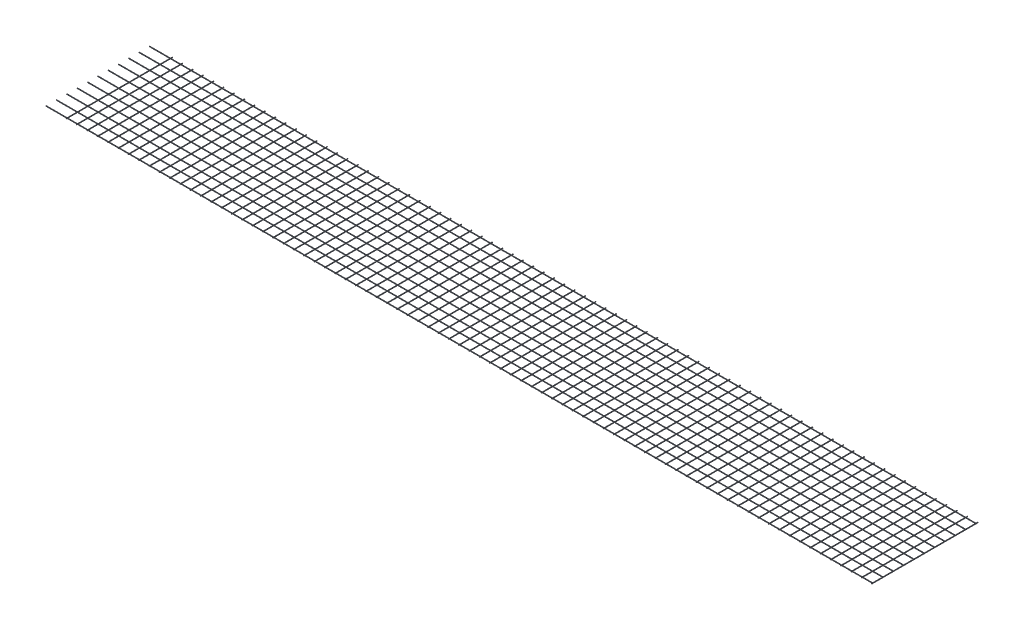
from build123d import *

# Parameters (mm, degrees)
SKETCH1_R              = 2.5
BOSS_EXTRUDE1_DEPTH    = 1025
SKETCH2_R              = 2.5
BOSS_EXTRUDE2_DEPTH    = 8000
BOSS_EXTRUDE2_2_DEPTH  = 8000
BOSS_EXTRUDE2_3_DEPTH  = 8000
BOSS_EXTRUDE2_4_DEPTH  = 8000
BOSS_EXTRUDE2_5_DEPTH  = 8000
BOSS_EXTRUDE2_6_DEPTH  = 8000
BOSS_EXTRUDE2_7_DEPTH  = 8000
BOSS_EXTRUDE2_8_DEPTH  = 8000
BOSS_EXTRUDE2_9_DEPTH  = 8000
BOSS_EXTRUDE2_10_DEPTH = 8000
BOSS_EXTRUDE2_11_DEPTH = 8000


with BuildPart() as part:
    # Sketch1 → Boss-Extrude1 (new body)
    with BuildSketch(Plane.XY):
        with Locations((-76.350701064, 0)):
            Circle(SKETCH1_R)
        with Locations((23.649298936, 0)):
            Circle(SKETCH1_R)
        with Locations((123.649298936, 0)):
            Circle(SKETCH1_R)
        with Locations((223.649298936, 0)):
            Circle(SKETCH1_R)
        with Locations((323.649298936, 0)):
            Circle(SKETCH1_R)
        with Locations((423.649298936, 0)):
            Circle(SKETCH1_R)
        with Locations((523.649298936, 0)):
            Circle(SKETCH1_R)
        with Locations((623.649298936, 0)):
            Circle(SKETCH1_R)
        with Locations((723.649298936, 0)):
            Circle(SKETCH1_R)
        with Locations((823.649298936, 0)):
            Circle(SKETCH1_R)
        with Locations((923.649298936, 0)):
            Circle(SKETCH1_R)
        with Locations((1023.649298936, 0)):
            Circle(SKETCH1_R)
        with Locations((1123.649298936, 0)):
            Circle(SKETCH1_R)
        with Locations((1223.649298936, 0)):
            Circle(SKETCH1_R)
        with Locations((1323.649298936, 0)):
            Circle(SKETCH1_R)
        with Locations((1423.649298936, 0)):
            Circle(SKETCH1_R)
        with Locations((1523.649298936, 0)):
            Circle(SKETCH1_R)
        with Locations((1623.649298936, 0)):
            Circle(SKETCH1_R)
        with Locations((1723.649298936, 0)):
            Circle(SKETCH1_R)
        with Locations((1823.649298936, 0)):
            Circle(SKETCH1_R)
        with Locations((1923.649298936, 0)):
            Circle(SKETCH1_R)
        with Locations((2023.649298936, 0)):
            Circle(SKETCH1_R)
        with Locations((2123.649298936, 0)):
            Circle(SKETCH1_R)
        with Locations((2223.649298936, 0)):
            Circle(SKETCH1_R)
        with Locations((2323.649298936, 0)):
            Circle(SKETCH1_R)
        with Locations((2423.649298936, 0)):
            Circle(SKETCH1_R)
        with Locations((2523.649298936, 0)):
            Circle(SKETCH1_R)
        with Locations((2623.649298936, 0)):
            Circle(SKETCH1_R)
        with Locations((2723.649298936, 0)):
            Circle(SKETCH1_R)
        with Locations((2823.649298936, 0)):
            Circle(SKETCH1_R)
        with Locations((2923.649298936, 0)):
            Circle(SKETCH1_R)
        with Locations((3023.649298936, 0)):
            Circle(SKETCH1_R)
        with Locations((3123.649298936, 0)):
            Circle(SKETCH1_R)
        with Locations((3223.649298936, 0)):
            Circle(SKETCH1_R)
        with Locations((3323.649298936, 0)):
            Circle(SKETCH1_R)
        with Locations((3423.649298936, 0)):
            Circle(SKETCH1_R)
        with Locations((3523.649298936, 0)):
            Circle(SKETCH1_R)
        with Locations((3623.649298936, 0)):
            Circle(SKETCH1_R)
        with Locations((3723.649298936, 0)):
            Circle(SKETCH1_R)
        with Locations((3823.649298936, 0)):
            Circle(SKETCH1_R)
        with Locations((3923.649298936, 0)):
            Circle(SKETCH1_R)
        with Locations((4023.649298936, 0)):
            Circle(SKETCH1_R)
        with Locations((4123.649298936, 0)):
            Circle(SKETCH1_R)
        with Locations((4223.649298936, 0)):
            Circle(SKETCH1_R)
        with Locations((4323.649298936, 0)):
            Circle(SKETCH1_R)
        with Locations((4423.649298936, 0)):
            Circle(SKETCH1_R)
        with Locations((4523.649298936, 0)):
            Circle(SKETCH1_R)
        with Locations((4623.649298936, 0)):
            Circle(SKETCH1_R)
        with Locations((4723.649298936, 0)):
            Circle(SKETCH1_R)
        with Locations((4823.649298936, 0)):
            Circle(SKETCH1_R)
        with Locations((4923.649298936, 0)):
            Circle(SKETCH1_R)
        with Locations((5023.649298936, 0)):
            Circle(SKETCH1_R)
        with Locations((5123.649298936, 0)):
            Circle(SKETCH1_R)
        with Locations((5223.649298936, 0)):
            Circle(SKETCH1_R)
        with Locations((5323.649298936, 0)):
            Circle(SKETCH1_R)
        with Locations((5423.649298936, 0)):
            Circle(SKETCH1_R)
        with Locations((5523.649298936, 0)):
            Circle(SKETCH1_R)
        with Locations((5623.649298936, 0)):
            Circle(SKETCH1_R)
        with Locations((5723.649298936, 0)):
            Circle(SKETCH1_R)
        with Locations((5823.649298936, 0)):
            Circle(SKETCH1_R)
        with Locations((5923.649298936, 0)):
            Circle(SKETCH1_R)
        with Locations((6023.649298936, 0)):
            Circle(SKETCH1_R)
        with Locations((6123.649298936, 0)):
            Circle(SKETCH1_R)
        with Locations((6223.649298936, 0)):
            Circle(SKETCH1_R)
        with Locations((6323.649298936, 0)):
            Circle(SKETCH1_R)
        with Locations((6423.649298936, 0)):
            Circle(SKETCH1_R)
        with Locations((6523.649298936, 0)):
            Circle(SKETCH1_R)
        with Locations((6623.649298936, 0)):
            Circle(SKETCH1_R)
        with Locations((6723.649298936, 0)):
            Circle(SKETCH1_R)
        with Locations((6823.649298936, 0)):
            Circle(SKETCH1_R)
        with Locations((6923.649298936, 0)):
            Circle(SKETCH1_R)
        with Locations((7023.649298936, 0)):
            Circle(SKETCH1_R)
        with Locations((7123.649298936, 0)):
            Circle(SKETCH1_R)
        with Locations((7223.649298936, 0)):
            Circle(SKETCH1_R)
        with Locations((7323.649298936, 0)):
            Circle(SKETCH1_R)
        with Locations((7423.649298936, 0)):
            Circle(SKETCH1_R)
        with Locations((7523.649298936, 0)):
            Circle(SKETCH1_R)
        with Locations((7623.649298936, 0)):
            Circle(SKETCH1_R)
        with Locations((7723.649298936, 0)):
            Circle(SKETCH1_R)
    extrude(amount=BOSS_EXTRUDE1_DEPTH)


with BuildPart() as body_2:
    # Sketch2 → Boss-Extrude2 (new body)
    with BuildSketch(Plane(origin=(7726.149298936, 0, 0), x_dir=(0, 0, -1), z_dir=(1, 0, 0))):
        with Locations((-1022.5, 5)):
            Circle(SKETCH2_R)
    extrude(amount=-BOSS_EXTRUDE2_DEPTH)


with BuildPart() as body_3:
    # Sketch2 → Boss-Extrude2 2 (new body)
    with BuildSketch(Plane(origin=(7726.149298936, 0, 0), x_dir=(0, 0, -1), z_dir=(1, 0, 0))):
        with Locations((-922.5, 5)):
            Circle(SKETCH2_R)
    extrude(amount=-BOSS_EXTRUDE2_2_DEPTH)


with BuildPart() as body_4:
    # Sketch2 → Boss-Extrude2 3 (new body)
    with BuildSketch(Plane(origin=(7726.149298936, 0, 0), x_dir=(0, 0, -1), z_dir=(1, 0, 0))):
        with Locations((-822.5, 5)):
            Circle(SKETCH2_R)
    extrude(amount=-BOSS_EXTRUDE2_3_DEPTH)


with BuildPart() as body_5:
    # Sketch2 → Boss-Extrude2 4 (new body)
    with BuildSketch(Plane(origin=(7726.149298936, 0, 0), x_dir=(0, 0, -1), z_dir=(1, 0, 0))):
        with Locations((-722.5, 5)):
            Circle(SKETCH2_R)
    extrude(amount=-BOSS_EXTRUDE2_4_DEPTH)


with BuildPart() as body_6:
    # Sketch2 → Boss-Extrude2 5 (new body)
    with BuildSketch(Plane(origin=(7726.149298936, 0, 0), x_dir=(0, 0, -1), z_dir=(1, 0, 0))):
        with Locations((-622.5, 5)):
            Circle(SKETCH2_R)
    extrude(amount=-BOSS_EXTRUDE2_5_DEPTH)


with BuildPart() as body_7:
    # Sketch2 → Boss-Extrude2 6 (new body)
    with BuildSketch(Plane(origin=(7726.149298936, 0, 0), x_dir=(0, 0, -1), z_dir=(1, 0, 0))):
        with Locations((-522.5, 5)):
            Circle(SKETCH2_R)
    extrude(amount=-BOSS_EXTRUDE2_6_DEPTH)


with BuildPart() as body_8:
    # Sketch2 → Boss-Extrude2 7 (new body)
    with BuildSketch(Plane(origin=(7726.149298936, 0, 0), x_dir=(0, 0, -1), z_dir=(1, 0, 0))):
        with Locations((-422.5, 5)):
            Circle(SKETCH2_R)
    extrude(amount=-BOSS_EXTRUDE2_7_DEPTH)


with BuildPart() as body_9:
    # Sketch2 → Boss-Extrude2 8 (new body)
    with BuildSketch(Plane(origin=(7726.149298936, 0, 0), x_dir=(0, 0, -1), z_dir=(1, 0, 0))):
        with Locations((-322.5, 5)):
            Circle(SKETCH2_R)
    extrude(amount=-BOSS_EXTRUDE2_8_DEPTH)


with BuildPart() as body_10:
    # Sketch2 → Boss-Extrude2 9 (new body)
    with BuildSketch(Plane(origin=(7726.149298936, 0, 0), x_dir=(0, 0, -1), z_dir=(1, 0, 0))):
        with Locations((-222.5, 5)):
            Circle(SKETCH2_R)
    extrude(amount=-BOSS_EXTRUDE2_9_DEPTH)


with BuildPart() as body_11:
    # Sketch2 → Boss-Extrude2 10 (new body)
    with BuildSketch(Plane(origin=(7726.149298936, 0, 0), x_dir=(0, 0, -1), z_dir=(1, 0, 0))):
        with Locations((-122.5, 5)):
            Circle(SKETCH2_R)
    extrude(amount=-BOSS_EXTRUDE2_10_DEPTH)


with BuildPart() as body_12:
    # Sketch2 → Boss-Extrude2 11 (new body)
    with BuildSketch(Plane(origin=(7726.149298936, 0, 0), x_dir=(0, 0, -1), z_dir=(1, 0, 0))):
        with Locations((-22.5, 5)):
            Circle(SKETCH2_R)
    extrude(amount=-BOSS_EXTRUDE2_11_DEPTH)


solid = Compound([part.part, body_2.part, body_3.part, body_4.part, body_5.part, body_6.part, body_7.part, body_8.part, body_9.part, body_10.part, body_11.part, body_12.part])
